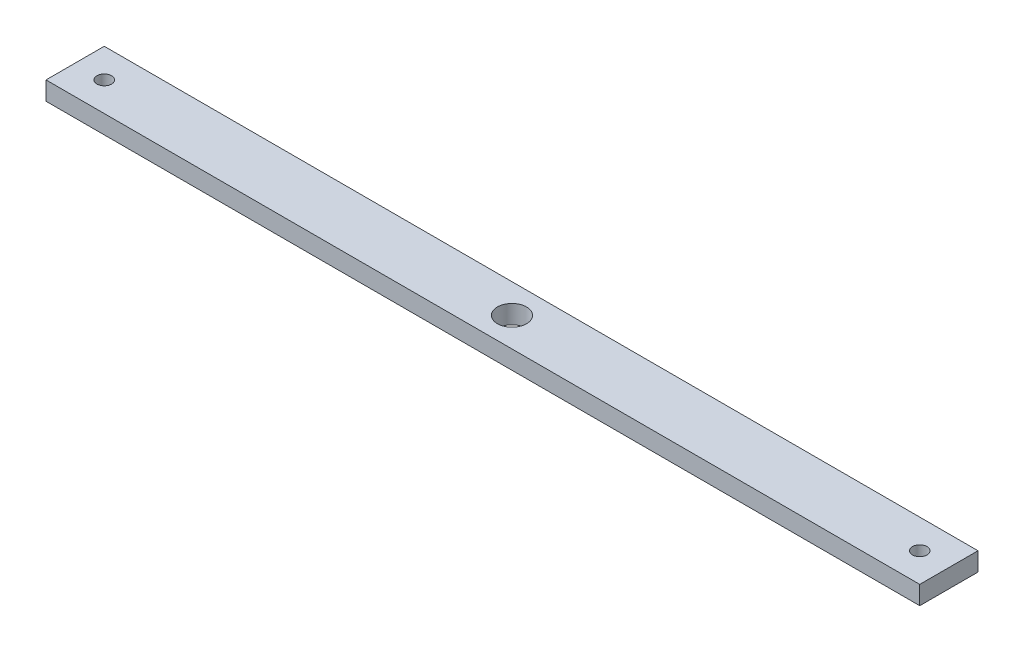
from build123d import *

# Parameters (mm, degrees)
SKETCH1_W           = 300
SKETCH1_H           = 20
SKETCH1_R           = 5
SKETCH1_R_2         = 2.5
BOSS_EXTRUDE1_DEPTH = 3.175


with BuildPart() as part:
    # Sketch1 → Boss-Extrude1 (new, symmetric)
    with BuildSketch(Plane(origin=(0, 0, 0), x_dir=(1, 0, 0), z_dir=(0, 1, 0))):
        Rectangle(SKETCH1_W, SKETCH1_H)
        with Locations(Location((0, 0, 0), (0, 0, 270))):
            Circle(SKETCH1_R, mode=Mode.SUBTRACT)
        with Locations(Location((-140, 0, 0), (0, 0, 270))):
            Circle(SKETCH1_R_2, mode=Mode.SUBTRACT)
        with Locations(Location((140, 0, 0), (0, 0, 270))):
            Circle(SKETCH1_R_2, mode=Mode.SUBTRACT)
    extrude(amount=BOSS_EXTRUDE1_DEPTH, both=True)


solid = part.part
